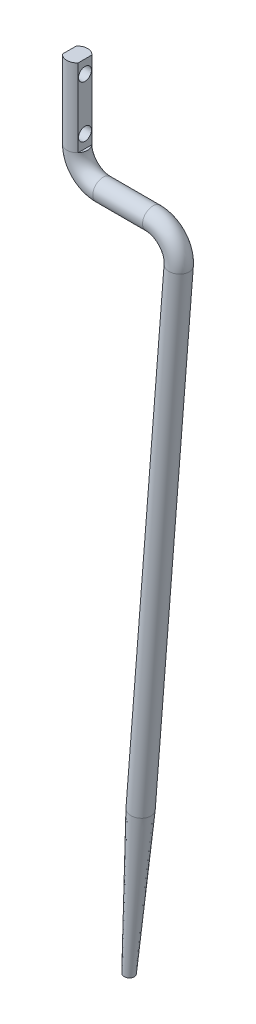
from build123d import *

# Parameters (mm, degrees)
SKETCH3_R             = 4
CHAMFER1_SIZE         = 2
CHAMFER1_SIZE2        = 57.272506566
SKETCH4_OUTSIDE_W     = 109.39
SKETCH4_OUTSIDE_H     = 70.198
SKETCH4_OUTSIDE_W_2   = 6
SKETCH4_OUTSIDE_H_2   = 35.530215116
EXTRUDE1_DEPTH        = 30
M6_TAPPED_HOLE1_D     = 5
M6_TAPPED_HOLE1_DEPTH = 9
M6_TAPPED_HOLE1_TIP   = 1.502151548


with BuildPart() as part:
    # Sweep1: sweep along a path in Sketch1
    with BuildLine(Plane.XY) as sweep1_path:
        Line((0, 40), (0, 10))
        ThreePointArc((0, 10), (2.928932188, 2.928932188), (10, 0))
        Line((10, 0), (29.191555041, 0))
        ThreePointArc((29.191555041, 0), (36.531808546, -3.208779308), (39.161411338, -10.775864303))
        Line((39.161411338, -10.775864303), (20, -257))
    # Sketch3 → Sweep1 (sweep)
    with BuildSketch(Plane(origin=(0, 40, 0), x_dir=(1, 0, 0), z_dir=(0, 1, 0))):
        Circle(SKETCH3_R)
    sweep(path=sweep1_path.line)

    # Chamfer1
    chamfer1_edges = [part.edges().sort_by_distance(p)[0] for p in [
        (16.012057481, -256.689654279, 0),
    ]]
    chamfer1_side = [part.faces().sort_by_distance(p)[0] for p in [
        (20, -257, 0),
    ]]
    chamfer(chamfer1_edges, length=CHAMFER1_SIZE, length2=CHAMFER1_SIZE2, reference=chamfer1_side[0])

    # Sketch4 outside → Extrude1 (cut)
    with BuildSketch(Plane(origin=(0, 40, 0), x_dir=(1, 0, 0), z_dir=(0, 1, 0))):
        with Locations((19.596, 0)):
            Rectangle(SKETCH4_OUTSIDE_W, SKETCH4_OUTSIDE_H)
        Rectangle(SKETCH4_OUTSIDE_W_2, SKETCH4_OUTSIDE_H_2, mode=Mode.SUBTRACT)
    extrude(amount=-EXTRUDE1_DEPTH, mode=Mode.SUBTRACT)

    # M6 Tapped Hole1
    with Locations(Plane(origin=(3, 0, 0), x_dir=(0, 0, -1), z_dir=(1, 0, 0))):
        with Locations((0, 35), (0, 15)):
            Hole(M6_TAPPED_HOLE1_D / 2, depth=M6_TAPPED_HOLE1_DEPTH)
            with Locations((0, 0, -(M6_TAPPED_HOLE1_DEPTH + M6_TAPPED_HOLE1_TIP / 2))):  # 118° drill point
                Cone(0, M6_TAPPED_HOLE1_D / 2, M6_TAPPED_HOLE1_TIP, mode=Mode.SUBTRACT)


solid = part.part
